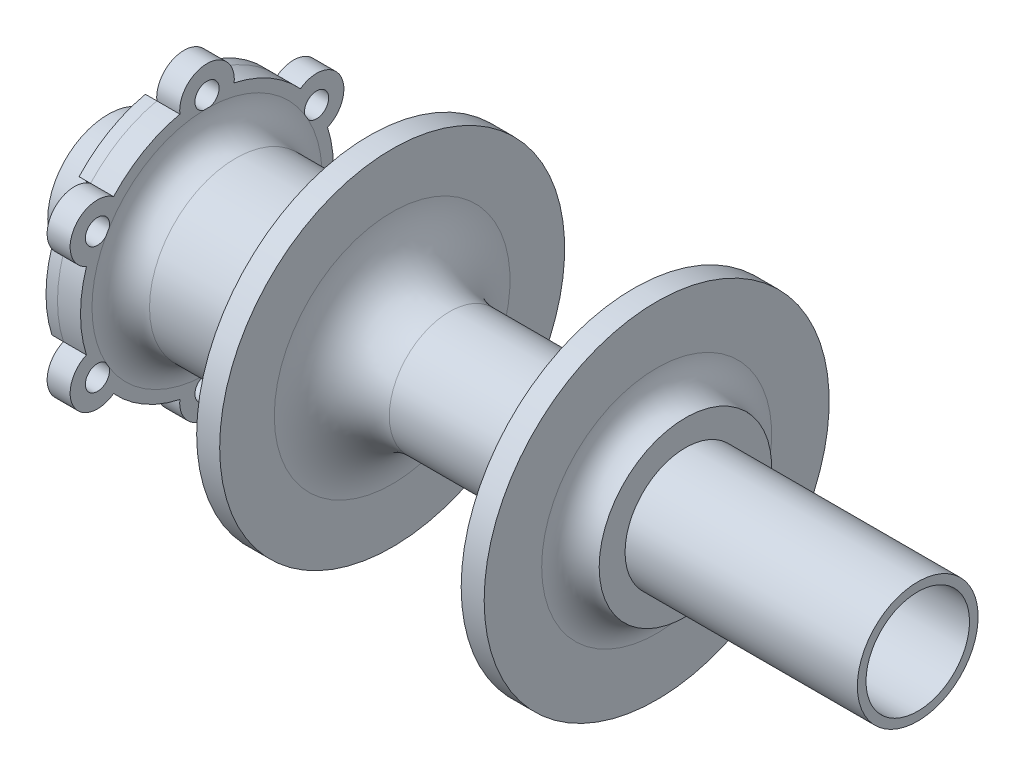
from build123d import *

# Parameters (mm, degrees)
CUT_EXTRUDE1_REACH        = 136.468
SKETCH2_R                 = 27.5
M5X0_8_TAPPED_HOLE1_D     = 4.2
M5X0_8_TAPPED_HOLE1_DEPTH = 4
BOSS_EXTRUDE1_START       = 2
SKETCH5_R                 = 10.5
BOSS_EXTRUDE1_DEPTH       = 2
FILLET1_R                 = 5


with BuildPart() as part:
    # Sketch1 → Revolve1 (revolve)
    with BuildSketch(Plane.XY, mode=Mode.PRIVATE) as revolve1_sk:
        with BuildLine():
            Line((0, 30), (0, 20))
            ThreePointArc((0, 20), (-1.464466094, 16.464466094), (-5, 15))
            Line((-5, 15), (-23.2, 15))
            ThreePointArc((-23.2, 15), (-26.735533906, 16.464466094), (-28.2, 20))
            Line((-28.2, 20), (-28.2, 26.875))
            Line((-28.2, 26.875), (-32.2, 26.875))
            Line((-32.2, 26.875), (-32.2, 10.5))
            Line((-32.2, 10.5), (-45.4, 10.5))
            Line((-45.4, 10.5), (-45.4, 9))
            Line((-45.4, 9), (-31.4, 9))
            Line((-31.4, 9), (-31.4, 6.4))
            Line((-31.4, 6.4), (81.4, 6.4))
            Line((81.4, 6.4), (81.4, 9))
            Line((81.4, 9), (95.4, 9))
            Line((95.4, 9), (95.4, 10.5))
            Line((95.4, 10.5), (55, 10.5))
            Line((55, 10.5), (55, 15))
            ThreePointArc((55, 15), (51.464466094, 16.464466094), (50, 20))
            Line((50, 20), (50, 30))
            Line((50, 30), (46, 30))
            Line((46, 30), (46, 20.5))
            ThreePointArc((46, 20.5), (43.071067812, 13.428932188), (36, 10.5))
            Line((36, 10.5), (14, 10.5))
            ThreePointArc((14, 10.5), (6.928932188, 13.428932188), (4, 20.5))
            Line((4, 20.5), (4, 30))
            Line((4, 30), (0, 30))
        make_face()
    revolve(revolve1_sk.sketch.rotate(Axis((0, 0, 0), (1, 0, 0)), 90), axis=Axis((0, 0, 0), (1, 0, 0)))

    # Sketch2 → Cut-Extrude1 (cut, up to next)
    with BuildSketch(Plane.ZY.offset(32.2), mode=Mode.PRIVATE) as cut_extrude1_sk1:
        Circle(SKETCH2_R)
        with BuildLine():
            ThreePointArc((-4.722240197, 21.487215909), (-11, 19.052558883), (-16.247354735, 14.833187928))
            ThreePointArc((-16.247354735, 14.833187928), (-23.166179551, 13.375), (-20.969594932, 6.654027981))
            ThreePointArc((-20.969594932, 6.654027981), (-22, 0), (-20.969594932, -6.654027981))
            ThreePointArc((-20.969594932, -6.654027981), (-23.166179551, -13.375), (-16.247354735, -14.833187928))
            ThreePointArc((-16.247354735, -14.833187928), (-11, -19.052558883), (-4.722240197, -21.487215909))
            ThreePointArc((-4.722240197, -21.487215909), (0, -26.75), (4.722240197, -21.487215909))
            ThreePointArc((4.722240197, -21.487215909), (11, -19.052558883), (16.247354735, -14.833187928))
            ThreePointArc((16.247354735, -14.833187928), (23.166179551, -13.375), (20.969594932, -6.654027981))
            ThreePointArc((20.969594932, -6.654027981), (22, 0), (20.969594932, 6.654027981))
            ThreePointArc((20.969594932, 6.654027981), (23.166179551, 13.375), (16.247354735, 14.833187928))
            ThreePointArc((16.247354735, 14.833187928), (11, 19.052558883), (4.722240197, 21.487215909))
            ThreePointArc((4.722240197, 21.487215909), (0, 26.75), (-4.722240197, 21.487215909))
        make_face(mode=Mode.SUBTRACT)
    cut_extrude1_tool1 = extrude(cut_extrude1_sk1.sketch, amount=-CUT_EXTRUDE1_REACH, mode=Mode.PRIVATE) & part.part
    add(cut_extrude1_tool1.solids().sort_by_distance((-32.2, 0, -26.722183))[0], mode=Mode.SUBTRACT)

    # M5x0.8 Tapped Hole1
    with Locations(Plane.ZY.offset(32.2)):
        with Locations((-19.052558883, 11), (0, 22), (19.052558883, 11), (19.052558883, -11), (0, -22), (-19.052558883, -11)):
            Hole(M5X0_8_TAPPED_HOLE1_D / 2, depth=M5X0_8_TAPPED_HOLE1_DEPTH)

    # Sketch5 → Boss-Extrude1 (add)
    with BuildSketch(Plane.ZY.offset(32.2).offset(BOSS_EXTRUDE1_START)):
        with BuildLine():
            ThreePointArc((-4.722240197, 21.487215909), (-11, 19.052558883), (-16.247354735, 14.833187928))
            ThreePointArc((-16.247354735, 14.833187928), (-14.938938215, 8.625), (-20.969594932, 6.654027981))
            ThreePointArc((-20.969594932, 6.654027981), (-22, 0), (-20.969594932, -6.654027981))
            ThreePointArc((-20.969594932, -6.654027981), (-14.938938215, -8.625), (-16.247354735, -14.833187928))
            ThreePointArc((-16.247354735, -14.833187928), (-11, -19.052558883), (-4.722240197, -21.487215909))
            ThreePointArc((-4.722240197, -21.487215909), (0, -17.25), (4.722240197, -21.487215909))
            ThreePointArc((4.722240197, -21.487215909), (11, -19.052558883), (16.247354735, -14.833187928))
            ThreePointArc((16.247354735, -14.833187928), (14.938938215, -8.625), (20.969594932, -6.654027981))
            ThreePointArc((20.969594932, -6.654027981), (22, 0), (20.969594932, 6.654027981))
            ThreePointArc((20.969594932, 6.654027981), (14.938938215, 8.625), (16.247354735, 14.833187928))
            ThreePointArc((16.247354735, 14.833187928), (11, 19.052558883), (4.722240197, 21.487215909))
            ThreePointArc((4.722240197, 21.487215909), (0, 17.25), (-4.722240197, 21.487215909))
        make_face()
        Circle(SKETCH5_R, mode=Mode.SUBTRACT)
    extrude(amount=-BOSS_EXTRUDE1_DEPTH)

    # Fillet1
    fillet1_edges = [part.edges().sort_by_distance(p)[0] for p in [
        (-34.2, 0, -10.5),
    ]]
    fillet(fillet1_edges, radius=FILLET1_R)


solid = part.part
